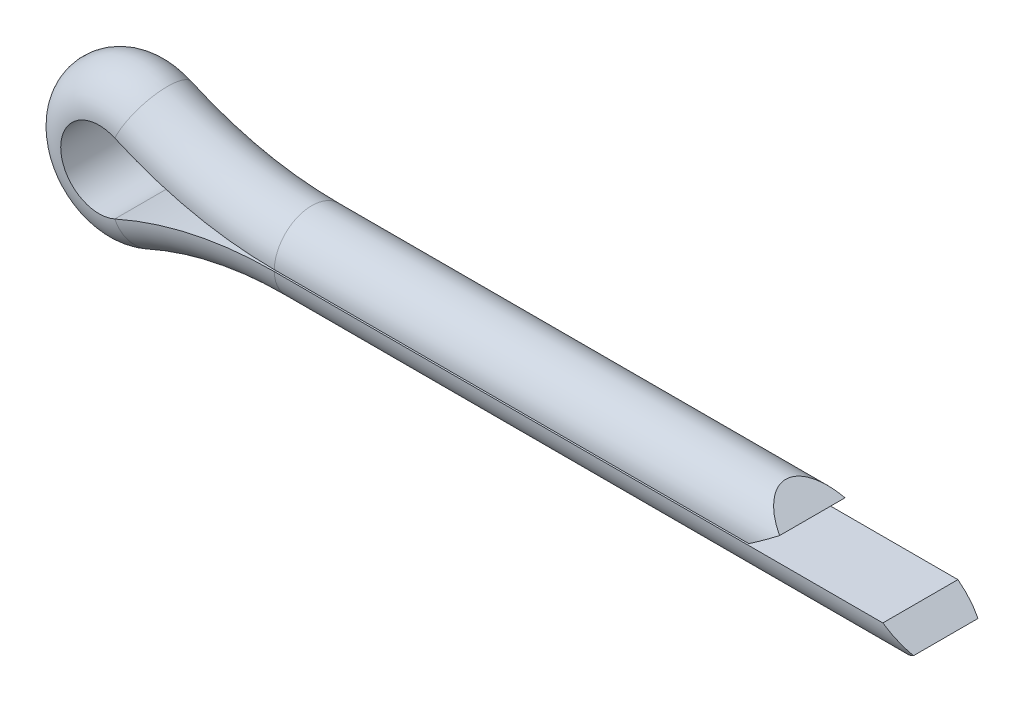
from build123d import *

# Parameters (mm, degrees)
CUT_EXTRUDE_1_DEPTH      = 10.752045953
CUT_EXTRUDE_1_DEPTH_BACK = 10.752045953


with BuildPart() as part:
    # 扫描2: sweep along a path in Sketch 200
    with BuildLine(Plane.XY) as sweep_2_path:
        Line((8.1, 0.45), (2.1, 0.45))
        ThreePointArc((2.1, 0.45), (1.2147396, 0.543784801), (0.368780488, 0.82097561))
        ThreePointArc((0.368780488, 0.82097561), (-0.9, 0), (0.368780488, -0.82097561))
        ThreePointArc((0.368780488, -0.82097561), (1.2147396, -0.543784801), (2.1, -0.45))
        Line((2.1, -0.45), (9.7, -0.45))
    # 草图2 → 扫描2 (sweep)
    with BuildSketch(Plane(origin=(8.1, 0.45, 0), x_dir=(0, 0, 1), z_dir=(-1, 0, 0))):
        with BuildLine():
            Line((-0.449888875, -0.44), (0.449888875, -0.44))
            ThreePointArc((0.449888875, -0.44), (0, 0), (-0.449888875, -0.44))
        make_face()
    sweep(path=sweep_2_path.line)

    # 草图3 → 切除-拉伸1 (cut, two sides: drawn at the far end of the back side and taken through both)
    with BuildSketch(Plane.XY.offset(-CUT_EXTRUDE_1_DEPTH_BACK)):
        Polygon((8.1, 0.22), (7.782167736, 0.45), (9.71, 0.45), (9.71, -0.45), (9.375165661, -0.45), (9.7, -0.23), (9.382167736, 0), (7.775165661, 0), align=None)
    extrude(amount=CUT_EXTRUDE_1_DEPTH + CUT_EXTRUDE_1_DEPTH_BACK, mode=Mode.SUBTRACT)


solid = part.part
